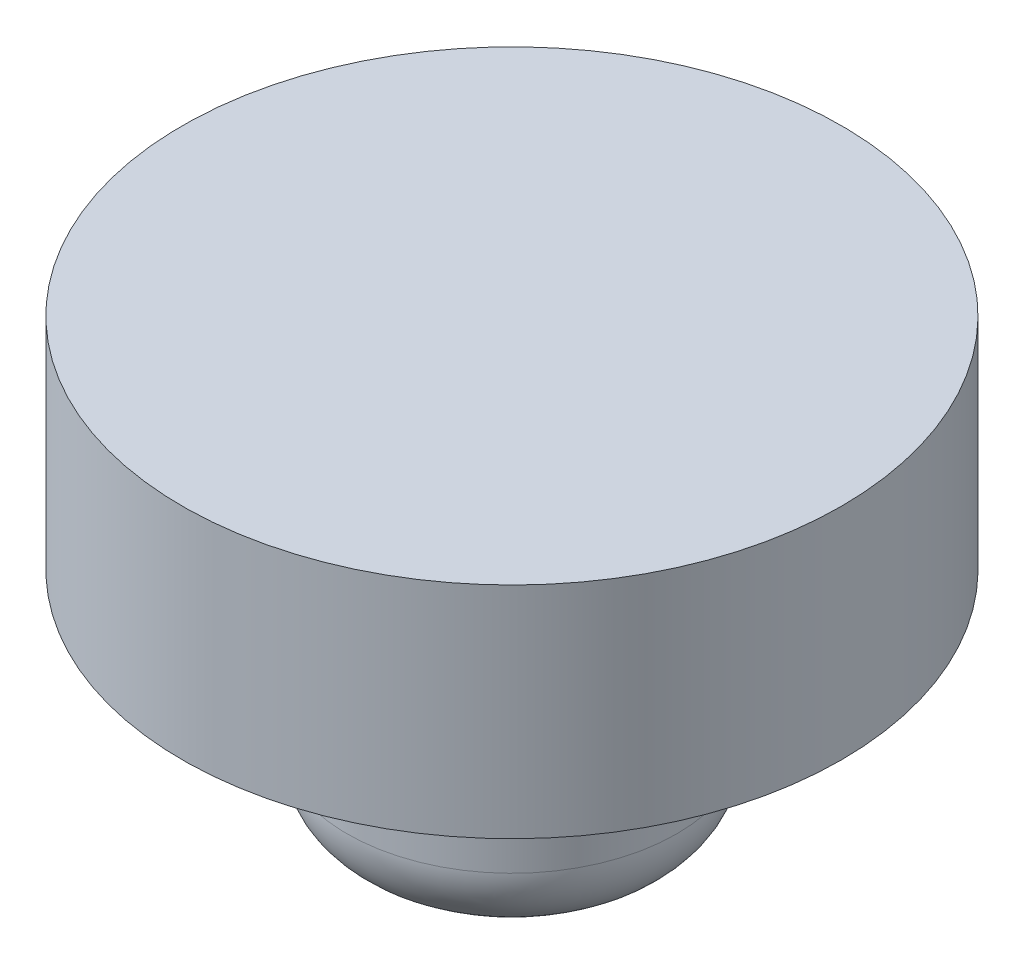
from build123d import *

# Parameters (mm, degrees)
SKETCH1_R           = 45
SKETCH1_R_2         = 22.5
BOSS_EXTRUDE1_DEPTH = 30
SKETCH2_R           = 22.5
BOSS_EXTRUDE2_DEPTH = 60
FILLET1_R           = 10


with BuildPart() as part:
    # Sketch1 → Boss-Extrude1 (new body)
    with BuildSketch(Plane.XZ.offset(270)):
        with Locations((70, 999.189515243)):
            Circle(SKETCH1_R)
        with Locations((70, 999.189515243)):
            Circle(SKETCH1_R_2, mode=Mode.SUBTRACT)
    extrude(amount=BOSS_EXTRUDE1_DEPTH)

    # Sketch2 → Boss-Extrude2 (add)
    with BuildSketch(Plane.XZ.offset(270)):
        with Locations((70, 999.189515243)):
            Circle(SKETCH2_R)
    extrude(amount=BOSS_EXTRUDE2_DEPTH)

    # Fillet1
    fillet1_edges = [part.edges().sort_by_distance(p)[0] for p in [
        (47.5, -330, 999.189515243),
    ]]
    fillet(fillet1_edges, radius=FILLET1_R)


solid = part.part
